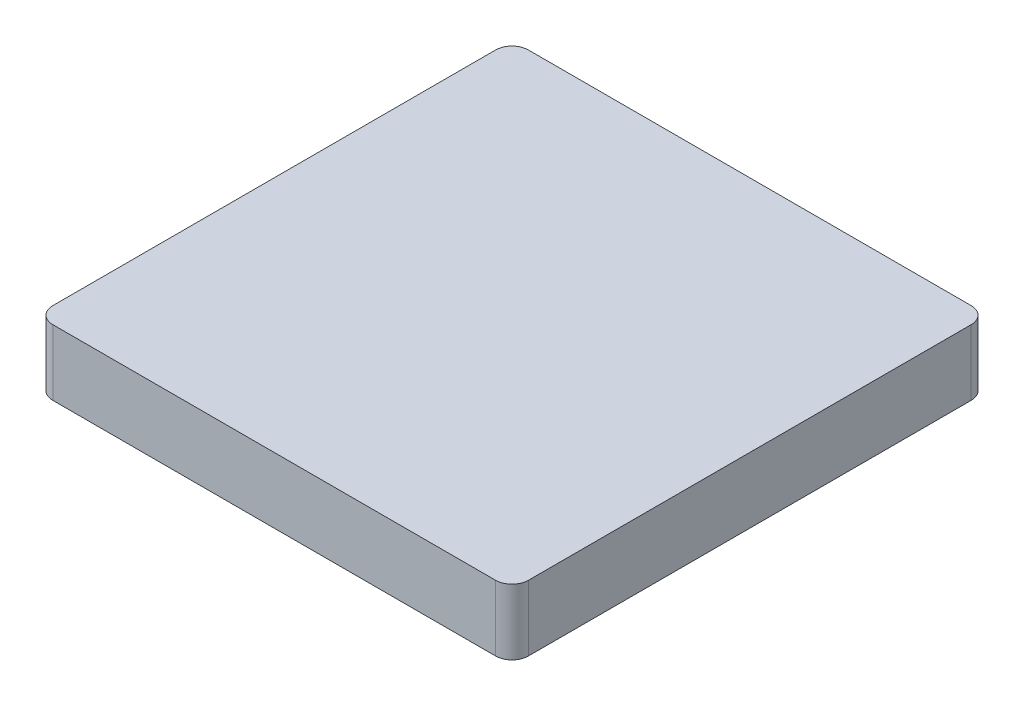
from build123d import *

# Parameters (mm, degrees)
SKETCH1_W           = 58
SKETCH1_H           = 58
BOSS_EXTRUDE1_DEPTH = 8
FILLET1_R           = 2


with BuildPart() as part:
    # Sketch1 → Boss-Extrude1 (new body)
    with BuildSketch(Plane(origin=(0, 0, 0), x_dir=(1, 0, 0), z_dir=(0, 1, 0))):
        Rectangle(SKETCH1_W, SKETCH1_H)
    extrude(amount=BOSS_EXTRUDE1_DEPTH)

    # Fillet1
    fillet1_edges = [part.edges().sort_by_distance(p)[0] for p in [
        (-29, 4, -29),
        (29, 4, -29),
        (29, 4, 29),
        (-29, 4, 29),
    ]]
    fillet(fillet1_edges, radius=FILLET1_R)


solid = part.part
